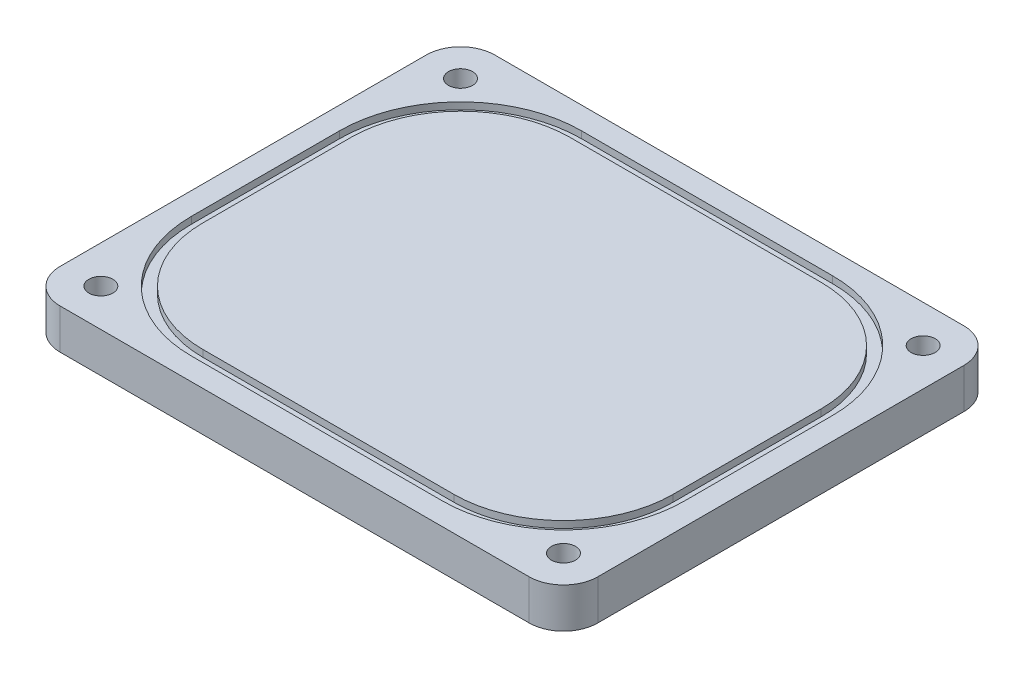
from build123d import *

# Parameters (mm, degrees)
SKETCH1_W               = 94
SKETCH1_H               = 76
BOSS_EXTRUDE1_DEPTH     = 7
FILLET1_R               = 6
CUT_EXTRUDE1_DEPTH      = 61.844062981
CUT_EXTRUDE1_DEPTH_BACK = 61.844062981
SKETCH2_R               = 2.1
CUT_EXTRUDE2_DEPTH      = 1.2
CUT_EXTRUDE5_DEPTH      = 3.5
CUT_EXTRUDE6_DEPTH      = 0.25


with BuildPart() as part:
    # Sketch1 → Boss-Extrude1 (new body)
    with BuildSketch(Plane(origin=(0, 0, 0), x_dir=(1, 0, 0), z_dir=(0, 1, 0))):
        Rectangle(SKETCH1_W, SKETCH1_H)
    extrude(amount=BOSS_EXTRUDE1_DEPTH)

    # Fillet1
    fillet1_edges = [part.edges().sort_by_distance(p)[0] for p in [
        (47, 3.5, 38),
        (-47, 3.5, 38),
        (-47, 3.5, -38),
        (47, 3.5, -38),
    ]]
    fillet(fillet1_edges, radius=FILLET1_R)

    # Sketch2 → Cut-Extrude1 (cut, two sides: drawn at the far end of the back side and taken through both)
    with BuildSketch(Plane(origin=(0, 7, 0), x_dir=(1, 0, 0), z_dir=(0, 1, 0)).offset(-CUT_EXTRUDE1_DEPTH_BACK)):
        with Locations(Location((-40.44, 31.44, 0), (0, 0, 270))):
            Circle(SKETCH2_R)
        with Locations(Location((40.44, 31.44, 0), (0, 0, 270))):
            Circle(SKETCH2_R)
        with Locations(Location((40.44, -31.44, 0), (0, 0, 270))):
            Circle(SKETCH2_R)
        with Locations(Location((-40.44, -31.44, 0), (0, 0, 270))):
            Circle(SKETCH2_R)
    extrude(amount=CUT_EXTRUDE1_DEPTH + CUT_EXTRUDE1_DEPTH_BACK, mode=Mode.SUBTRACT)

    # Sketch3 → Cut-Extrude2 (cut)
    with BuildSketch(Plane(origin=(0, 7, 0), x_dir=(1, 0, 0), z_dir=(0, 1, 0))):
        with BuildLine():
            Line((-21.96, 34.1), (21.96, 34.1))
            ThreePointArc((21.96, 34.1), (36.908237354, 27.908237354), (43.1, 12.96))
            Line((43.1, 12.96), (43.1, -12.96))
            ThreePointArc((43.1, -12.96), (36.908237354, -27.908237354), (21.96, -34.1))
            Line((21.96, -34.1), (-21.96, -34.1))
            ThreePointArc((-21.96, -34.1), (-36.908237354, -27.908237354), (-43.1, -12.96))
            Line((-43.1, -12.96), (-43.1, 12.96))
            ThreePointArc((-43.1, 12.96), (-36.908237354, 27.908237354), (-21.96, 34.1))
        make_face()
        with BuildLine():
            Line((-41.1, -12.96), (-41.1, 12.96))
            ThreePointArc((-41.1, 12.96), (-35.494023792, 26.494023792), (-21.96, 32.1))
            Line((-21.96, 32.1), (21.96, 32.1))
            ThreePointArc((21.96, 32.1), (35.494023792, 26.494023792), (41.1, 12.96))
            Line((41.1, 12.96), (41.1, -12.96))
            ThreePointArc((41.1, -12.96), (35.494023792, -26.494023792), (21.96, -32.1))
            Line((21.96, -32.1), (-21.96, -32.1))
            ThreePointArc((-21.96, -32.1), (-35.494023792, -26.494023792), (-41.1, -12.96))
        make_face(mode=Mode.SUBTRACT)
    extrude(amount=-CUT_EXTRUDE2_DEPTH, mode=Mode.SUBTRACT)

    # Sketch4 → Cut-Extrude5 (cut)
    with BuildSketch(Plane.XZ):
        Polygon((-44.182793618, 34.960629101), (-45.360351048, 29.958960196), (-41.61755743, 26.438331095), (-36.697206382, 27.919370899), (-35.519648952, 32.921039804), (-39.26244257, 36.441668905), align=None)
        Polygon((44.09008926, 35.056653387), (39.13293092, 36.409396719), (35.48284166, 32.792743332), (36.78991074, 27.823346613), (41.74706908, 26.470603281), (45.39715834, 30.087256668), align=None)
        Polygon((44.058119605, -35.08863589), (45.408871172, -30.130934454), (41.790751568, -26.482298563), (36.821880395, -27.79136411), (35.471128828, -32.749065546), (39.089248432, -36.397701437), align=None)
        Polygon((-44.010563884, -35.135186989), (-39.025156137, -36.379792524), (-35.454592254, -32.684605534), (-36.869436116, -27.744813011), (-41.854843863, -26.500207476), (-45.425407746, -30.195394466), align=None)
    extrude(amount=-CUT_EXTRUDE5_DEPTH, mode=Mode.SUBTRACT)

    # Sketch6 → Cut-Extrude6 (cut)
    with BuildSketch(Plane.XZ):
        Polygon((-2.849358974, 3.5), (-2.512820513, 3.5), (-1.346153846, 0.741786859), (-0.179487179, 3.5), (0.157051282, 3.5), (-1.323717949, 0), (-1.368589744, 0), align=None)
        with BuildLine():
            Line((0.919871795, 2.692307692), (0.605769231, 2.692307692))
            add(Edge.make_bspline(
                [(0.605769231, 2.692307692), (0.614278781, 2.727540176), (0.630914257, 2.796416801), (0.66561183, 2.894824062), (0.703411086, 2.987947583), (0.74880019, 3.074043657), (0.798308944, 3.154842559), (0.855031666, 3.228511684), (0.916351389, 3.296924649), (0.984176338, 3.357637887), (1.055305, 3.412615616), (1.130739619, 3.459490673), (1.208962513, 3.499814826), (1.290515646, 3.533035058), (1.375641818, 3.558060582), (1.463571441, 3.576217387), (1.554534941, 3.588008502), (1.616282532, 3.589159265), (1.647636218, 3.58974359)],
                knots=[0, 0, 0, 0, 1.162005537, 2.271625781, 3.343758855, 4.383309926, 5.390229558, 6.379919256, 7.361854164, 8.333198761, 9.295911338, 10.242430842, 11.177959212, 12.116337295, 13.062827104, 14.020064771, 14.994644689, 16, 16, 16, 16], degree=3))
            add(Edge.make_bspline(
                [(1.647636218, 3.58974359), (1.69331896, 3.588364359), (1.783687971, 3.585635984), (1.916451018, 3.560721548), (2.044477837, 3.521296415), (2.166367085, 3.466822688), (2.279585517, 3.399635375), (2.380321704, 3.319670638), (2.467210215, 3.228471337), (2.540104593, 3.127738772), (2.597179592, 3.020083263), (2.639265965, 2.909283106), (2.664887646, 2.795601134), (2.668208203, 2.718843855), (2.669871795, 2.680388622)],
                knots=[0, 0, 0, 0, 1.083050992, 2.142477498, 3.193116406, 4.255571735, 5.30263384, 6.308962982, 7.297363603, 8.282367274, 9.249857812, 10.179914175, 11.08814088, 12, 12, 12, 12], degree=3))
            add(Edge.make_bspline(
                [(2.669871795, 2.680388622), (2.668708204, 2.643381827), (2.666431237, 2.570965273), (2.647097531, 2.465243775), (2.614561268, 2.365602175), (2.569491506, 2.271621013), (2.511149955, 2.183896173), (2.440477259, 2.102230282), (2.356974597, 2.026261124), (2.293695659, 1.982741651), (2.261117788, 1.960336538)],
                knots=[0, 0, 0, 0, 1.024540389, 2.004866551, 2.965041327, 3.920577974, 4.882998113, 5.874504559, 6.905732034, 8, 8, 8, 8], degree=3))
            add(Edge.make_bspline(
                [(2.261117788, 1.960336538), (2.298349543, 1.942358367), (2.372116417, 1.906738409), (2.472666947, 1.836882652), (2.563944822, 1.756226304), (2.614848541, 1.693283652), (2.640424679, 1.661658654)],
                knots=[0, 0, 0, 0, 1.015518401, 2.012035669, 3.001164323, 4, 4, 4, 4], degree=3))
            add(Edge.make_bspline(
                [(2.640424679, 1.661658654), (2.657266022, 1.638600902), (2.690672918, 1.592862986), (2.731908452, 1.51932656), (2.769317566, 1.444975071), (2.798467785, 1.367815664), (2.821041652, 1.288742651), (2.837177684, 1.207620255), (2.847201825, 1.124382232), (2.848637377, 1.068069752), (2.849358974, 1.039763622)],
                knots=[0, 0, 0, 0, 1.025084078, 2.033381695, 3.024893161, 4.013698104, 4.991890475, 5.976764909, 6.982997093, 8, 8, 8, 8], degree=3))
            add(Edge.make_bspline(
                [(2.849358974, 1.039763622), (2.847564461, 0.990753901), (2.843983879, 0.892965099), (2.811979805, 0.748490377), (2.762366564, 0.607264875), (2.691909628, 0.472190036), (2.606042119, 0.345809655), (2.503884795, 0.232733346), (2.386598386, 0.135534741), (2.255792738, 0.054324513), (2.114075609, -0.010593409), (1.962500017, -0.055650852), (1.803249963, -0.084996852), (1.694042666, -0.08814372), (1.638521635, -0.08974359)],
                knots=[0, 0, 0, 0, 0.955779014, 1.907060117, 2.875433937, 3.871313158, 4.872415639, 5.851225146, 6.836215519, 7.83643374, 8.849228613, 9.86973379, 10.916971861, 12, 12, 12, 12], degree=3))
            add(Edge.make_bspline(
                [(1.638521635, -0.08974359), (1.601102334, -0.088875376), (1.527473629, -0.087167022), (1.419230131, -0.075488421), (1.315908432, -0.054158416), (1.217368834, -0.025455111), (1.123523797, 0.010936632), (1.034659692, 0.05625533), (0.950229799, 0.109566832), (0.871030847, 0.171500419), (0.79707228, 0.240781759), (0.730319555, 0.318640769), (0.669659763, 0.403638173), (0.616717124, 0.496761229), (0.569080171, 0.596806487), (0.529899215, 0.705054985), (0.495413646, 0.820539007), (0.479380182, 0.901016747), (0.471153846, 0.942307692)],
                knots=[0, 0, 0, 0, 1.048658725, 2.063410685, 3.046034179, 4.001477787, 4.936774919, 5.862367409, 6.792675028, 7.730719943, 8.675894397, 9.627829632, 10.600096036, 11.597688215, 12.626045268, 13.701542398, 14.82072376, 16, 16, 16, 16], degree=3))
            Line((0.471153846, 0.942307692), (0.78525641, 0.942307692))
            add(Edge.make_bspline(
                [(0.78525641, 0.942307692), (0.793439702, 0.915358679), (0.809356914, 0.862940507), (0.836451212, 0.787500202), (0.867319484, 0.718342149), (0.900434043, 0.654959027), (0.935212489, 0.596726624), (0.974127414, 0.545184755), (1.014296559, 0.498069553), (1.044575913, 0.471524941), (1.059395032, 0.458533654)],
                knots=[0, 0, 0, 0, 1.198163088, 2.33053128, 3.407730985, 4.417276592, 5.372219308, 6.28897303, 7.162600585, 8, 8, 8, 8], degree=3))
            add(Edge.make_bspline(
                [(1.059395032, 0.458533654), (1.078991609, 0.44342532), (1.118124271, 0.413255288), (1.181892503, 0.37475366), (1.248957389, 0.341392634), (1.320772063, 0.315908939), (1.395786833, 0.294331278), (1.475214199, 0.280210759), (1.558353416, 0.270522587), (1.615121179, 0.269667656), (1.644130609, 0.269230769)],
                knots=[0, 0, 0, 0, 0.946170439, 1.889420265, 2.845303464, 3.807233317, 4.801018734, 5.828864929, 6.890507805, 8, 8, 8, 8], degree=3))
            add(Edge.make_bspline(
                [(1.644130609, 0.269230769), (1.676884112, 0.269846674), (1.740930759, 0.271051024), (1.834385618, 0.282126731), (1.923293065, 0.298257144), (2.006665991, 0.323170127), (2.085596499, 0.353950979), (2.158978148, 0.392599384), (2.227774254, 0.437944106), (2.29110366, 0.489483264), (2.348049167, 0.545904759), (2.398188681, 0.60491783), (2.440813342, 0.66627366), (2.47519692, 0.730311781), (2.502347471, 0.79676701), (2.520830671, 0.865825839), (2.533682186, 0.936923105), (2.534728798, 0.985252074), (2.53525641, 1.009615385)],
                knots=[0, 0, 0, 0, 1.217147791, 2.380027433, 3.494444702, 4.572153297, 5.609568379, 6.639424714, 7.649109417, 8.668170816, 9.669597737, 10.625200337, 11.543417969, 12.441394052, 13.322311151, 14.205496177, 15.095365482, 16, 16, 16, 16], degree=3))
            add(Edge.make_bspline(
                [(2.53525641, 1.009615385), (2.533726109, 1.042226723), (2.53067312, 1.107287132), (2.507364541, 1.203004706), (2.469025677, 1.295228118), (2.415353165, 1.382383909), (2.350017437, 1.46315981), (2.27365253, 1.535231293), (2.185624301, 1.594701384), (2.104604432, 1.63579004), (2.032839276, 1.663827115), (1.971423891, 1.68250208), (1.902667288, 1.698315735), (1.827400939, 1.713028007), (1.745057723, 1.725549355), (1.655727285, 1.735991171), (1.559391523, 1.744346212), (1.492700357, 1.748077307), (1.458333333, 1.75)],
                knots=[0, 0, 0, 0, 1.07054697, 2.135767047, 3.216561865, 4.33974944, 5.486079747, 6.621378074, 7.775625952, 8.963672916, 9.598146892, 10.304877434, 11.070270905, 11.915000392, 12.823868403, 13.805723172, 14.86925407, 16, 16, 16, 16], degree=3))
            Line((1.458333333, 1.75), (1.458333333, 2.108974359))
            add(Edge.make_bspline(
                [(1.458333333, 2.108974359), (1.501634499, 2.109709163), (1.586450846, 2.111148463), (1.71034515, 2.128556473), (1.828818463, 2.152637101), (1.939245205, 2.189522293), (2.039893918, 2.23236259), (2.12721352, 2.2822148), (2.199980667, 2.337629549), (2.257841739, 2.399462158), (2.301370967, 2.465777206), (2.333197765, 2.534893864), (2.351998091, 2.607417924), (2.354507758, 2.656912592), (2.355769231, 2.681790865)],
                knots=[0, 0, 0, 0, 1.321986639, 2.589447074, 3.816329219, 5.01088745, 6.139805852, 7.153945165, 8.075214402, 8.924034688, 9.728124013, 10.488707548, 11.240355623, 12, 12, 12, 12], degree=3))
            add(Edge.make_bspline(
                [(2.355769231, 2.681790865), (2.35535482, 2.700068611), (2.354530369, 2.736431318), (2.344133091, 2.789556386), (2.32850905, 2.841057332), (2.307029321, 2.890715142), (2.278279122, 2.938185416), (2.243873136, 2.983872865), (2.202905035, 3.027516644), (2.155959588, 3.068196964), (2.105547783, 3.106966201), (2.050298008, 3.139879838), (1.991876134, 3.1680249), (1.930217479, 3.191234402), (1.865121948, 3.20869369), (1.796895391, 3.221229532), (1.725407707, 3.229067187), (1.676635975, 3.230195602), (1.651842949, 3.230769231)],
                knots=[0, 0, 0, 0, 0.884392785, 1.759457502, 2.611959086, 3.489218968, 4.37281399, 5.2945488, 6.255912374, 7.266815255, 8.301784654, 9.332968512, 10.37626691, 11.440494194, 12.520033166, 13.637162961, 14.798855837, 16, 16, 16, 16], degree=3))
            add(Edge.make_bspline(
                [(1.651842949, 3.230769231), (1.611991281, 3.229377869), (1.534151704, 3.226660215), (1.421936787, 3.202857202), (1.317617453, 3.164879118), (1.237878787, 3.119546099), (1.178996213, 3.074795665), (1.136919274, 3.035713279), (1.095598764, 2.992280455), (1.057753087, 2.94182208), (1.019479111, 2.887755289), (0.984634549, 2.827331608), (0.950774857, 2.762127214), (0.930372307, 2.716031579), (0.919871795, 2.692307692)],
                knots=[0, 0, 0, 0, 1.472543308, 2.876219568, 4.221790263, 5.565193594, 6.249813518, 6.953379497, 7.687249741, 8.463570142, 9.283606569, 10.136032583, 11.040678096, 12, 12, 12, 12], degree=3))
        make_face()
    extrude(amount=-CUT_EXTRUDE6_DEPTH, mode=Mode.SUBTRACT)


solid = part.part
